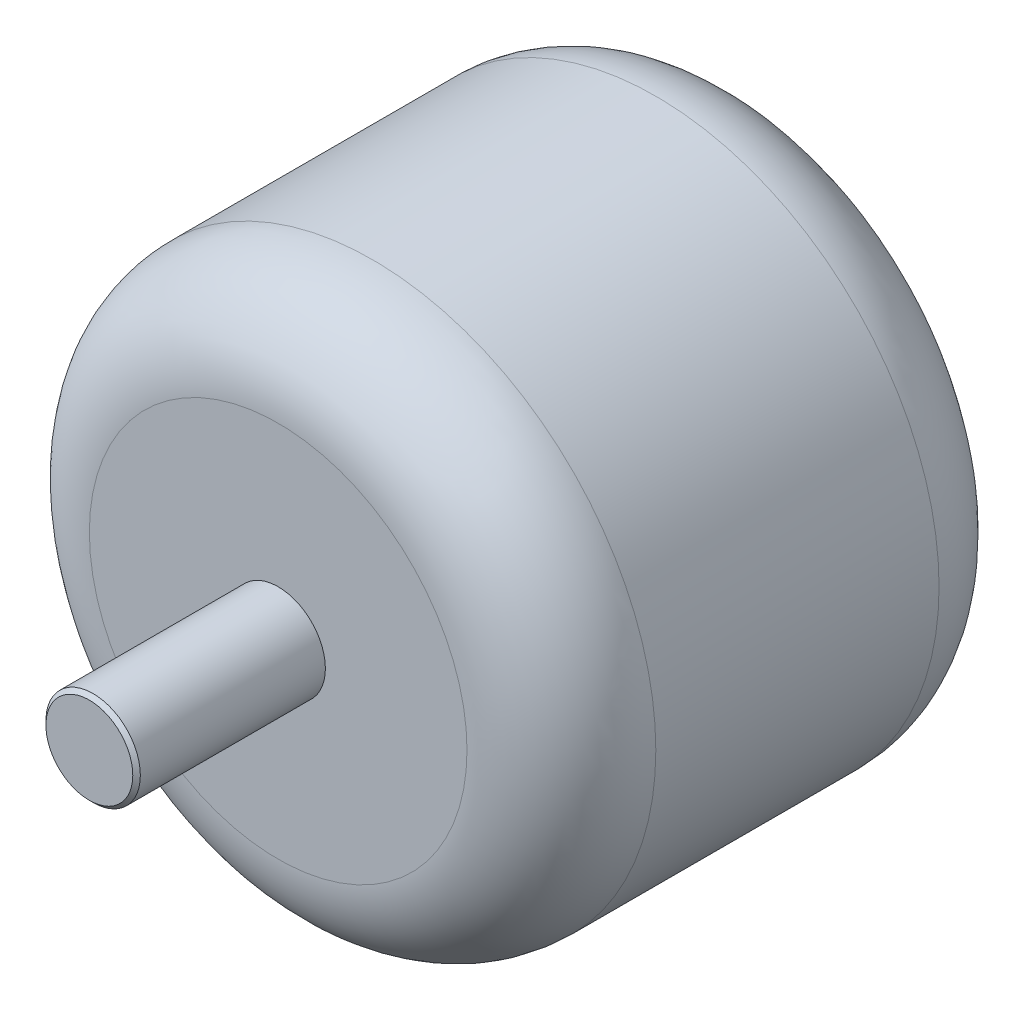
from build123d import *

# Parameters (mm, degrees)
BOSS_EXTRUDE1_DEPTH      = 15
BOSS_EXTRUDE1_DEPTH_BACK = 10
SKETCH1_R                = 15
FILLET1_R                = 5
SKETCH2_R                = 2.5
BOSS_EXTRUDE2_DEPTH      = 10
CHAMFER1_SIZE            = 0.2
SKETCH3_R                = 1
CUT_EXTRUDE1_DEPTH       = 3
CIRPATTERN1_COUNT        = 3


with BuildPart() as part:
    # Sketch1 → Boss-Extrude1 (new, two sides: drawn at the far end of the back side and taken through both)
    with BuildSketch(Plane.XY.offset(-BOSS_EXTRUDE1_DEPTH_BACK)):
        Circle(SKETCH1_R)
    extrude(amount=BOSS_EXTRUDE1_DEPTH + BOSS_EXTRUDE1_DEPTH_BACK)

    # Fillet1
    fillet1_edges = [part.edges().sort_by_distance(p)[0] for p in [
        (-15, 0, -10),
        (-15, 0, 15),
    ]]
    fillet(fillet1_edges, radius=FILLET1_R)

    # Sketch2 → Boss-Extrude2 (add)
    with BuildSketch(Plane.XY.offset(15)):
        Circle(SKETCH2_R)
    extrude(amount=BOSS_EXTRUDE2_DEPTH)

    # Chamfer1
    chamfer1_edges = [part.edges().sort_by_distance(p)[0] for p in [
        (-2.5, 0, 25),
    ]]
    chamfer(chamfer1_edges, length=CHAMFER1_SIZE)

    # Sketch3 → Cut-Extrude1 (cut)
    with BuildSketch(Plane(origin=(0, 0, -10), x_dir=(-1, 0, 0), z_dir=(0, 0, -1))):
        with Locations((0, 6)):
            Circle(SKETCH3_R)
    cut_extrude1 = extrude(amount=-CUT_EXTRUDE1_DEPTH, mode=Mode.SUBTRACT)

    # CirPattern1: Cut-Extrude1 ×3 about axis
    cirpattern1_axis = Axis((0, 0, 0), (0, 0, 1))
    for i in range(1, CIRPATTERN1_COUNT):
        add(cut_extrude1.rotate(cirpattern1_axis, i * 360 / CIRPATTERN1_COUNT), mode=Mode.SUBTRACT)


solid = part.part
